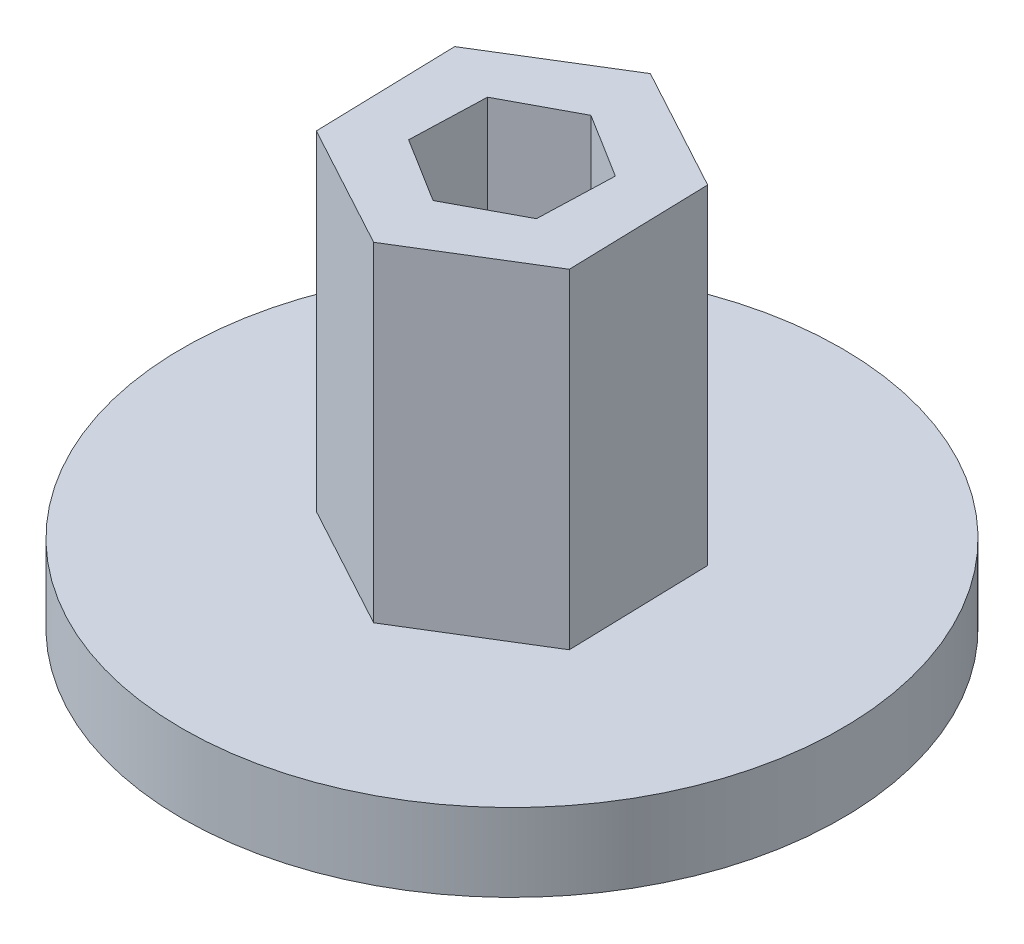
from build123d import *

# Parameters (mm, degrees)
SKETCH1_R           = 12.7
BOSS_EXTRUDE1_DEPTH = 3
BOSS_EXTRUDE2_DEPTH = 12.7
CUT_EXTRUDE1_DEPTH  = 23


with BuildPart() as part:
    # Sketch1 → Boss-Extrude1 (new body)
    with BuildSketch(Plane(origin=(0, 0, 0), x_dir=(1, 0, 0), z_dir=(0, 1, 0))):
        with Locations(Location((0, 0, 0), (0, 0, 270))):
            Circle(SKETCH1_R)
    extrude(amount=BOSS_EXTRUDE1_DEPTH)

    # Sketch2 → Boss-Extrude2 (add)
    with BuildSketch(Plane(origin=(0, 3, 0), x_dir=(1, 0, 0), z_dir=(0, 1, 0))):
        Polygon((0.148889151, -5.48), (4.820263788, -2.611058213), (4.671374637, 2.868941787), (-0.148889151, 5.48), (-4.820263788, 2.611058213), (-4.671374637, -2.868941787), align=None)
    extrude(amount=BOSS_EXTRUDE2_DEPTH)

    # Sketch6 → Cut-Extrude1 (cut)
    with BuildSketch(Plane(origin=(0, 15.7, 0), x_dir=(1, 0, 0), z_dir=(0, 1, 0))):
        Polygon((-2.597868549, -1.386029942), (-0.098597134, -2.94283513), (2.499271415, -1.556805188), (2.597868549, 1.386029942), (0.098597134, 2.94283513), (-2.499271415, 1.556805188), align=None)
    extrude(amount=-CUT_EXTRUDE1_DEPTH, mode=Mode.SUBTRACT)


solid = part.part
